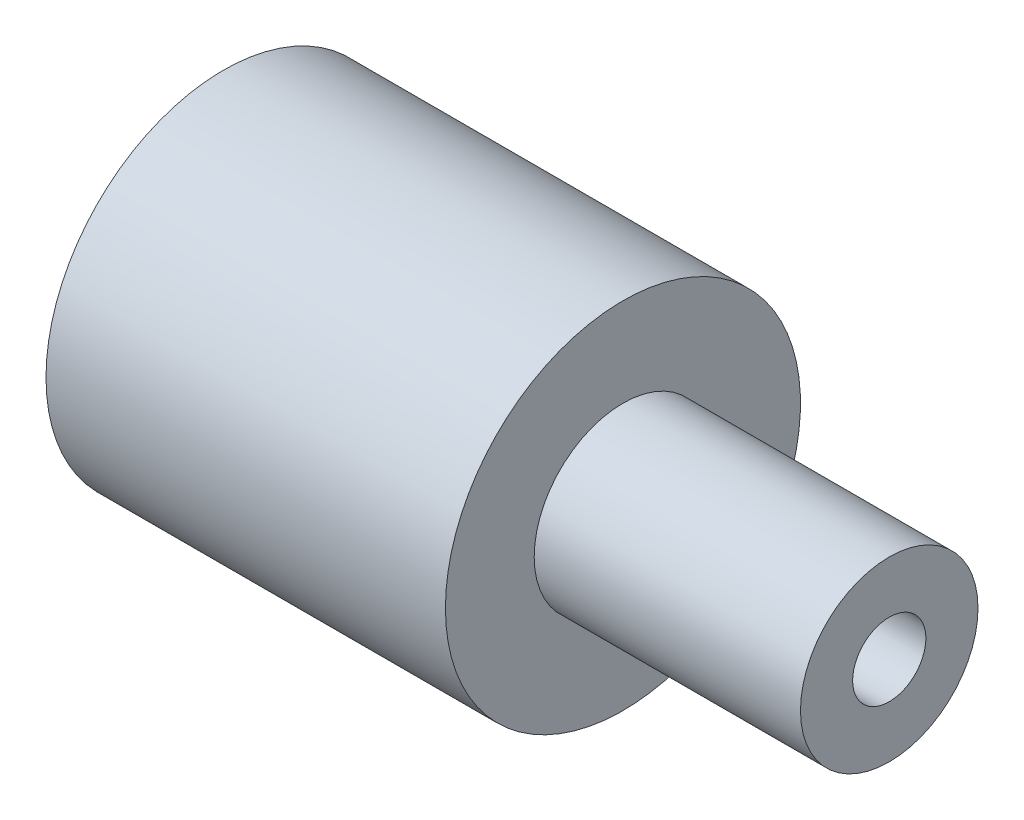
from build123d import *

# Parameters (mm, degrees)
TROU_TARAUD_M41_D = 3.3


with BuildPart() as part:
    # Esquisse1 → Révolution1 (revolve)
    with BuildSketch(Plane.XY, mode=Mode.PRIVATE) as r_volution1_sk:
        Polygon((0, 0), (0, 8), (18, 8), (18, 4), (30, 4), (30, 0), align=None)
    revolve(r_volution1_sk.sketch.rotate(Axis((0, 0, 0), (1, 0, 0)), 90), axis=Axis((0, 0, 0), (1, 0, 0)))

    # Trou taraudé M41 (through all)
    with Locations(Plane.ZY):
        with Locations((0, 0)):
            Hole(TROU_TARAUD_M41_D / 2)


solid = part.part
